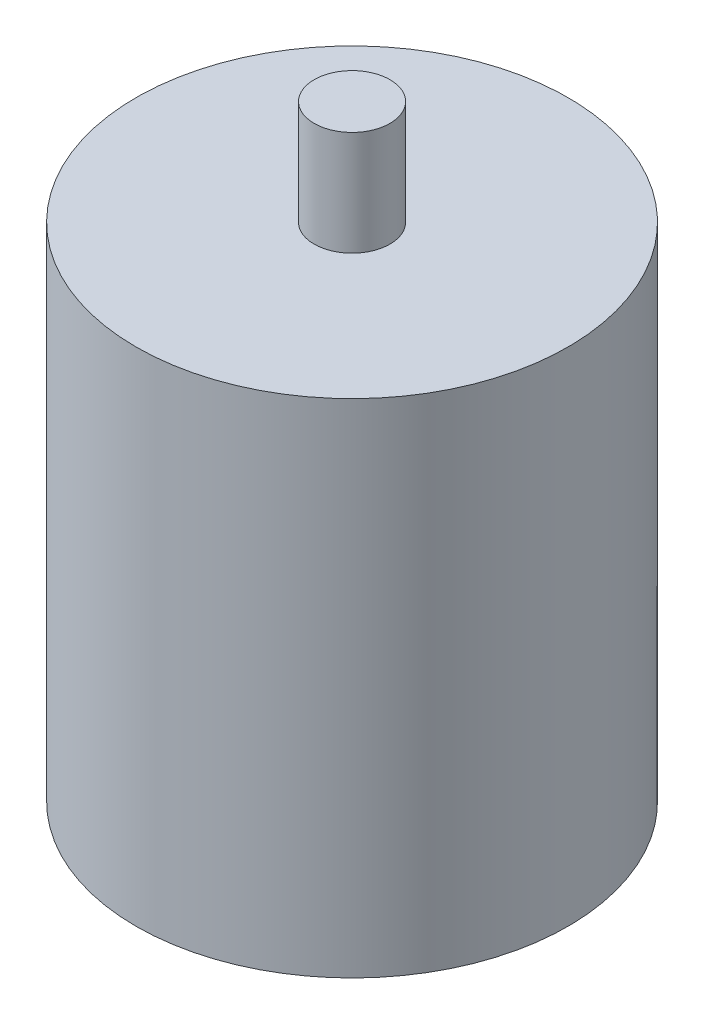
from build123d import *

# Parameters (mm, degrees)
SKETCH1_R           = 14.25
BOSS_EXTRUDE1_DEPTH = 33.1
SKETCH2_R           = 2.5
BOSS_EXTRUDE2_DEPTH = 40


with BuildPart() as part:
    # Sketch1 → Boss-Extrude1 (new body)
    with BuildSketch(Plane(origin=(0, 0, 0), x_dir=(1, 0, 0), z_dir=(0, 1, 0))):
        with Locations(Location((0, 0, 0), (0, 0, 270))):
            Circle(SKETCH1_R)
    extrude(amount=BOSS_EXTRUDE1_DEPTH)

    # Sketch2 → Boss-Extrude2 (add)
    with BuildSketch(Plane(origin=(0, 0, 0), x_dir=(1, 0, 0), z_dir=(0, 1, 0))):
        with Locations(Location((0, 0, 0), (0, 0, 270))):
            Circle(SKETCH2_R)
    extrude(amount=BOSS_EXTRUDE2_DEPTH)


solid = part.part
